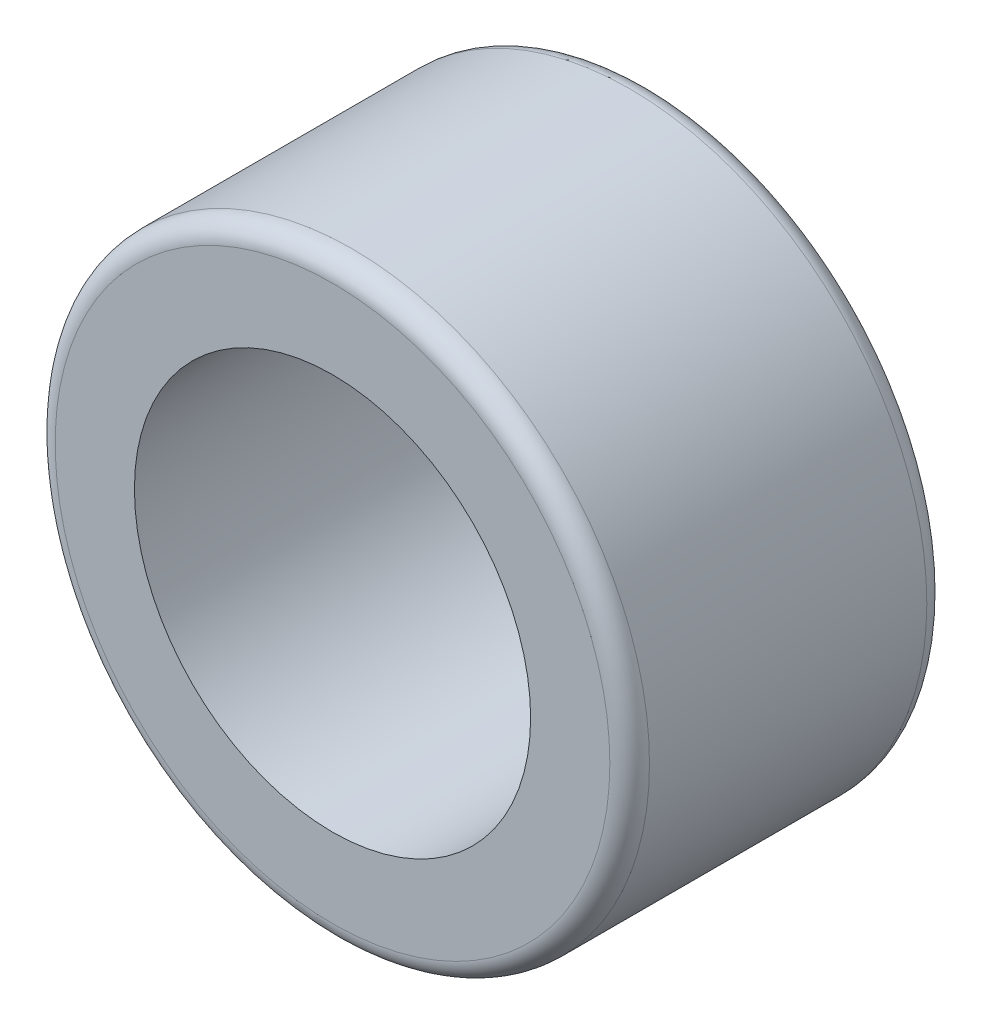
from build123d import *

# Parameters (mm, degrees)
SKETCH1_R           = 7.5
BOSS_EXTRUDE1_DEPTH = 8
SKETCH2_R           = 5
CUT_EXTRUDE1_DEPTH  = 14.285330256
FILLET1_R           = 0.5


with BuildPart() as part:
    # Sketch1 → Boss-Extrude1 (new body)
    with BuildSketch(Plane.XY):
        Circle(SKETCH1_R)
    extrude(amount=BOSS_EXTRUDE1_DEPTH)

    # Sketch2 → Cut-Extrude1 (cut, through all)
    with BuildSketch(Plane.XY.offset(8)):
        Circle(SKETCH2_R)
    extrude(amount=-CUT_EXTRUDE1_DEPTH, mode=Mode.SUBTRACT)

    # Fillet1
    fillet1_edges = [part.edges().sort_by_distance(p)[0] for p in [
        (-7.5, 0, 0),
        (-7.5, 0, 8),
    ]]
    fillet(fillet1_edges, radius=FILLET1_R)


solid = part.part
